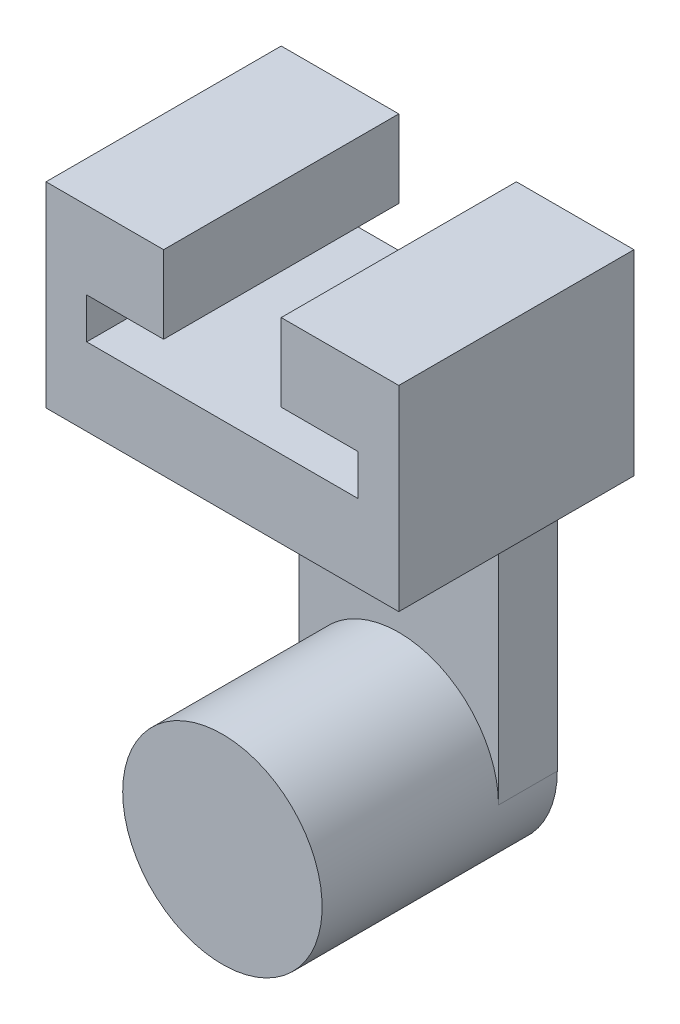
from build123d import *

# Parameters (mm, degrees)
SKETCH1_W           = 38.1
SKETCH1_H           = 8.382
BOSS_EXTRUDE1_DEPTH = 25.4
SKETCH2_W           = 4.3942
SKETCH2_H           = 4.3942
BOSS_EXTRUDE2_DEPTH = 25.4
SKETCH3_W           = 12.7
SKETCH3_H           = 8.382
BOSS_EXTRUDE3_DEPTH = 25.4
SKETCH4_W           = 21.5392
SKETCH4_H           = 31.75
BOSS_EXTRUDE4_DEPTH = 6.35
SKETCH5_R           = 10.7696
BOSS_EXTRUDE5_DEPTH = 25.4


with BuildPart() as part:
    # Sketch1 → Boss-Extrude1 (new body)
    with BuildSketch(Plane.XY):
        with Locations((-19.05, 4.191)):
            Rectangle(SKETCH1_W, SKETCH1_H)
    extrude(amount=BOSS_EXTRUDE1_DEPTH)

    # Sketch2 → Boss-Extrude2 (add)
    with BuildSketch(Plane.XY.offset(25.4)):
        with Locations((-35.9029, 10.5791)):
            Rectangle(SKETCH2_W, SKETCH2_H)
        with Locations((-2.1971, 10.5791)):
            Rectangle(SKETCH2_W, SKETCH2_H)
    extrude(amount=-BOSS_EXTRUDE2_DEPTH)

    # Sketch3 → Boss-Extrude3 (add)
    with BuildSketch(Plane.XY.offset(25.4)):
        with Locations((-31.75, 16.9672)):
            Rectangle(SKETCH3_W, SKETCH3_H)
        with Locations((-6.35, 16.9672)):
            Rectangle(SKETCH3_W, SKETCH3_H)
    extrude(amount=-BOSS_EXTRUDE3_DEPTH)


with BuildPart() as body_2:
    # Sketch4 → Boss-Extrude4 (new body)
    with BuildSketch(Plane(origin=(0, 0, 0), x_dir=(-1, 0, 0), z_dir=(0, 0, -1))):
        with Locations((19.05, -15.875)):
            Rectangle(SKETCH4_W, SKETCH4_H)
    extrude(amount=-BOSS_EXTRUDE4_DEPTH)

    # Sketch5 → Boss-Extrude5 (add)
    with BuildSketch(Plane(origin=(0, 0, 0), x_dir=(-1, 0, 0), z_dir=(0, 0, -1))):
        with Locations((19.05, -31.75)):
            Circle(SKETCH5_R)
    extrude(amount=-BOSS_EXTRUDE5_DEPTH)


solid = Compound([part.part, body_2.part])
